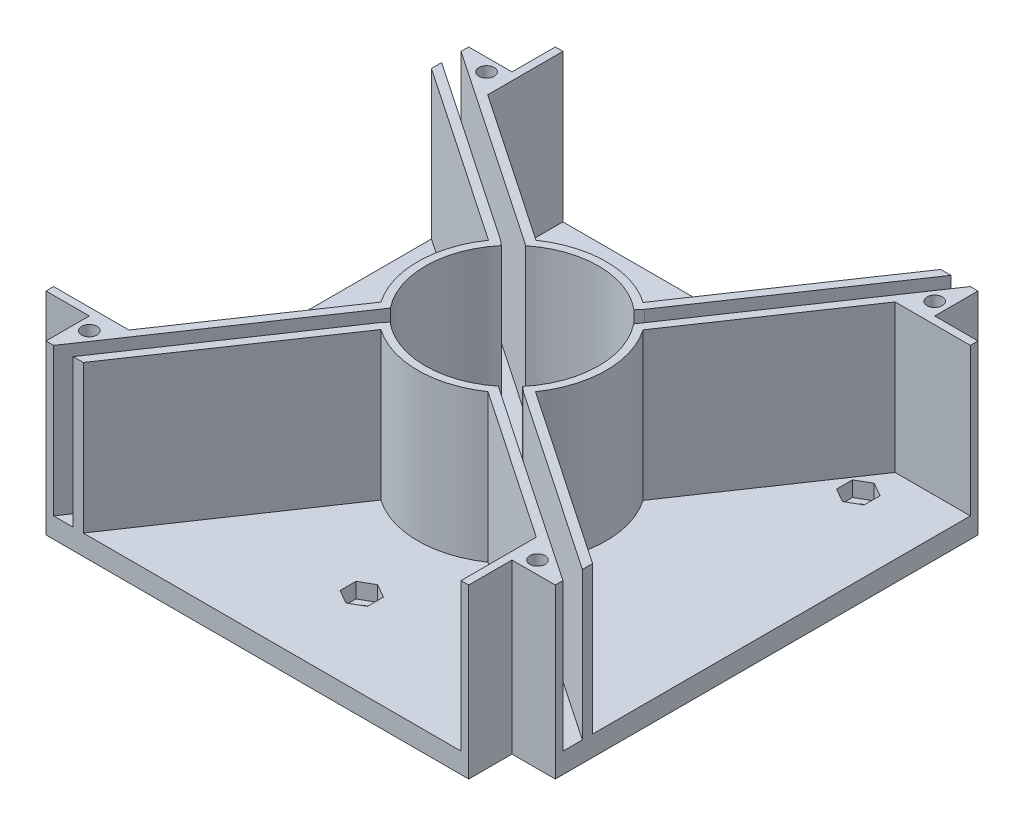
from build123d import *

# Parameters (mm, degrees)
SKETCH1_W           = 100
SKETCH1_H           = 100
BOSS_EXTRUDE1_DEPTH = 4
SKETCH2_R           = 4.7625
CUT_EXTRUDE1_DEPTH  = 71.823724839
SKETCH3_W           = 8.5
SKETCH3_H           = 8.5
CUT_EXTRUDE2_DEPTH  = 71.823724839
BOSS_EXTRUDE3_DEPTH = 29
BOSS_EXTRUDE4_DEPTH = 29
CUT_EXTRUDE4_DEPTH  = 77.426435217
BOSS_EXTRUDE5_DEPTH = 29
BOSS_EXTRUDE6_DEPTH = 29
SKETCH12_R          = 1.5
CUT_EXTRUDE5_DEPTH  = 79.0320447
CUT_EXTRUDE6_DEPTH  = 3
SKETCH15_R          = 1.5
CUT_EXTRUDE7_DEPTH  = 10


with BuildPart() as part:
    # Sketch1 → Boss-Extrude1 (new body)
    with BuildSketch(Plane(origin=(0, 0, 0), x_dir=(1, 0, 0), z_dir=(0, 1, 0))):
        Rectangle(SKETCH1_W, SKETCH1_H)
    extrude(amount=BOSS_EXTRUDE1_DEPTH)

    # Sketch2 → Cut-Extrude1 (cut, through all)
    with BuildSketch(Plane(origin=(0, 4, 0), x_dir=(1, 0, 0), z_dir=(0, 1, 0))):
        with Locations(Location((0, 0, 0), (0, 0, 270))):
            Circle(SKETCH2_R)
    extrude(amount=-CUT_EXTRUDE1_DEPTH, mode=Mode.SUBTRACT)

    # Sketch3 → Cut-Extrude2 (cut, through all)
    with BuildSketch(Plane(origin=(0, 4, 0), x_dir=(1, 0, 0), z_dir=(0, 1, 0))):
        with Locations((-45.75, 45.75)):
            Rectangle(SKETCH3_W, SKETCH3_H)
        with Locations((45.75, 45.75)):
            Rectangle(SKETCH3_W, SKETCH3_H)
        with Locations((45.75, -45.75)):
            Rectangle(SKETCH3_W, SKETCH3_H)
        with Locations((-45.75, -45.75)):
            Rectangle(SKETCH3_W, SKETCH3_H)
    extrude(amount=-CUT_EXTRUDE2_DEPTH, mode=Mode.SUBTRACT)

    # Sketch4 → Boss-Extrude3 (add)
    with BuildSketch(Plane(origin=(0, 4, 0), x_dir=(1, 0, 0), z_dir=(0, 1, 0))):
        with BuildLine():
            Line((-10.927389365, -13.022755533), (-11.891570779, -14.171822198))
            ThreePointArc((-11.891570779, -14.171822198), (0, -18.5), (11.891570779, -14.171822198))
            Line((11.891570779, -14.171822198), (10.927389365, -13.022755533))
            ThreePointArc((10.927389365, -13.022755533), (0, -17), (-10.927389365, -13.022755533))
        make_face()
        with BuildLine():
            Line((-13.022755533, -10.927389365), (-14.171822198, -11.891570779))
            ThreePointArc((-14.171822198, -11.891570779), (-18.5, 0), (-14.171822198, 11.891570779))
            Line((-14.171822198, 11.891570779), (-13.022755533, 10.927389365))
            ThreePointArc((-13.022755533, 10.927389365), (-17, 0), (-13.022755533, -10.927389365))
        make_face()
        with BuildLine():
            Line((-10.927389365, 13.022755533), (-11.891570779, 14.171822198))
            ThreePointArc((-11.891570779, 14.171822198), (0, 18.5), (11.891570779, 14.171822198))
            Line((11.891570779, 14.171822198), (10.927389365, 13.022755533))
            ThreePointArc((10.927389365, 13.022755533), (0, 17), (-10.927389365, 13.022755533))
        make_face()
        with BuildLine():
            Line((13.022755533, 10.927389365), (14.171822198, 11.891570779))
            ThreePointArc((14.171822198, 11.891570779), (18.5, 0), (14.171822198, -11.891570779))
            Line((14.171822198, -11.891570779), (13.022755533, -10.927389365))
            ThreePointArc((13.022755533, -10.927389365), (17, 0), (13.022755533, 10.927389365))
        make_face()
    extrude(amount=BOSS_EXTRUDE3_DEPTH)

    # Sketch7 → Boss-Extrude4 (add)
    with BuildSketch(Plane(origin=(0, 4, 0), x_dir=(1, 0, 0), z_dir=(0, 1, 0))):
        Polygon((-41.5, -41.5), (-41.5, -50), (-40, -50), (-40, -40), (-50, -40), (-50, -41.5), align=None)
        Polygon((40, -50), (40, -40), (50, -40), (50, -41.5), (41.5, -41.5), (41.5, -50), align=None)
        Polygon((50, 41.5), (50, 40), (40, 40), (40, 50), (41.5, 50), (41.5, 41.5), align=None)
        Polygon((-50, 41.5), (-50, 40), (-40, 40), (-40, 50), (-41.5, 50), (-41.5, 41.5), align=None)
    extrude(amount=BOSS_EXTRUDE4_DEPTH)

    # Sketch8 → Cut-Extrude4 (cut, through all)
    with BuildSketch(Plane(origin=(0, 4, 0), x_dir=(1, 0, 0), z_dir=(0, 1, 0))):
        Polygon((-14.171822198, -11.891570779), (-40, -50), (-36.17429682, -50), (-11.891570779, -14.171822198), (-9.867198001, -11.184942236), (-12.488706492, -9.408201793), align=None)
        Polygon((-11.891570779, 14.171822198), (-50, 40), (-50, 36.17429682), (-14.171822198, 11.891570779), (-11.184942236, 9.867198001), (-9.408201793, 12.488706492), align=None)
        Polygon((14.171822198, 11.891570779), (40, 50), (36.17429682, 50), (11.891570779, 14.171822198), (9.867198001, 11.184942236), (12.488706492, 9.408201793), align=None)
        Polygon((11.891570779, -14.171822198), (50, -40), (50, -36.17429682), (14.171822198, -11.891570779), (11.184942236, -9.867198001), (9.408201793, -12.488706492), align=None)
    extrude(amount=CUT_EXTRUDE4_DEPTH, mode=Mode.SUBTRACT)

    # Sketch9 → Boss-Extrude5 (add)
    with BuildSketch(Plane(origin=(0, 4, 0), x_dir=(1, 0, 0), z_dir=(0, 1, 0))):
        Polygon((-11.891570779, -14.171822198), (-36.17429682, -50), (-34.17429682, -50), (-10.52109933, -15.100666052), align=None)
        Polygon((-14.171822198, -11.891570779), (-40, -50), (-40, -47.049081084), (-14.981255079, -10.134937263), (-13.610783629, -11.063781117), align=None)
        Polygon((-50, 34.17429682), (-15.100666052, 10.52109933), (-14.171822198, 11.891570779), (-50, 36.17429682), align=None)
        Polygon((-11.891570779, 14.171822198), (-50, 40), (-47.049081084, 40), (-10.134937263, 14.981255079), (-11.063781117, 13.610783629), align=None)
        Polygon((34.17429682, 50), (10.52109933, 15.100666052), (11.891570779, 14.171822198), (36.17429682, 50), align=None)
        Polygon((14.171822198, 11.891570779), (40, 50), (40, 47.049081084), (14.981255079, 10.134937263), (13.610783629, 11.063781117), align=None)
        Polygon((50, -34.17429682), (15.100666052, -10.52109933), (14.171822198, -11.891570779), (50, -36.17429682), align=None)
        Polygon((11.891570779, -14.171822198), (50, -40), (47.049081084, -40), (10.134937263, -14.981255079), (11.063781117, -13.610783629), align=None)
    extrude(amount=BOSS_EXTRUDE5_DEPTH)

    # Sketch11 → Boss-Extrude6 (add)
    with BuildSketch(Plane(origin=(0, 4, 0), x_dir=(1, 0, 0), z_dir=(0, 1, 0))):
        Polygon((-40, -40), (-35.222450169, -40), (-40, -47.049081084), align=None)
        Polygon((-40, 40), (-40, 35.222450169), (-47.049081084, 40), align=None)
        Polygon((40, 40), (35.222450169, 40), (40, 47.049081084), align=None)
        Polygon((40, -40), (40, -35.222450169), (47.049081084, -40), align=None)
    extrude(amount=BOSS_EXTRUDE6_DEPTH)

    # Sketch12 → Cut-Extrude5 (cut, through all)
    with BuildSketch(Plane(origin=(0, 0, 0), x_dir=(-1, 0, 0), z_dir=(0, -1, 0))):
        with Locations(Location((-3.5, 33, 0), (0, 0, 90))):
            Circle(SKETCH12_R)
        with Locations(Location((-3.5, -33, 0), (0, 0, 90))):
            Circle(SKETCH12_R)
        with Locations(Location((-35, 33, 0), (0, 0, 90))):
            Circle(SKETCH12_R)
        with Locations(Location((-28, -33, 0), (0, 0, 90))):
            Circle(SKETCH12_R)
    extrude(amount=-CUT_EXTRUDE5_DEPTH, mode=Mode.SUBTRACT)

    # Sketch14 → Cut-Extrude6 (cut)
    with BuildSketch(Plane(origin=(0, 4, 0), x_dir=(1, 0, 0), z_dir=(0, 1, 0))):
        Polygon((28, -29.882308546), (25.3, -31.441154273), (25.3, -34.558845727), (28, -36.117691454), (30.7, -34.558845727), (30.7, -31.441154273), align=None)
        Polygon((3.5, -29.882308546), (0.8, -31.441154273), (0.8, -34.558845727), (3.5, -36.117691454), (6.2, -34.558845727), (6.2, -31.441154273), align=None)
        Polygon((3.5, 36.117691454), (0.8, 34.558845727), (0.8, 31.441154273), (3.5, 29.882308546), (6.2, 31.441154273), (6.2, 34.558845727), align=None)
        Polygon((35, 36.117691454), (32.3, 34.558845727), (32.3, 31.441154273), (35, 29.882308546), (37.7, 31.441154273), (37.7, 34.558845727), align=None)
    extrude(amount=-CUT_EXTRUDE6_DEPTH, mode=Mode.SUBTRACT)

    # Sketch15 → Cut-Extrude7 (cut)
    with BuildSketch(Plane(origin=(0, 33, 0), x_dir=(1, 0, 0), z_dir=(0, 1, 0))):
        with Locations(Location((44, -39, 0), (0, 0, 270))):
            Circle(SKETCH15_R)
        with Locations(Location((-39, -44, 0), (0, 0, 270))):
            Circle(SKETCH15_R)
        with Locations(Location((-44, 39, 0), (0, 0, 270))):
            Circle(SKETCH15_R)
        with Locations(Location((39, 44, 0), (0, 0, 270))):
            Circle(SKETCH15_R)
    extrude(amount=-CUT_EXTRUDE7_DEPTH, mode=Mode.SUBTRACT)


solid = part.part
